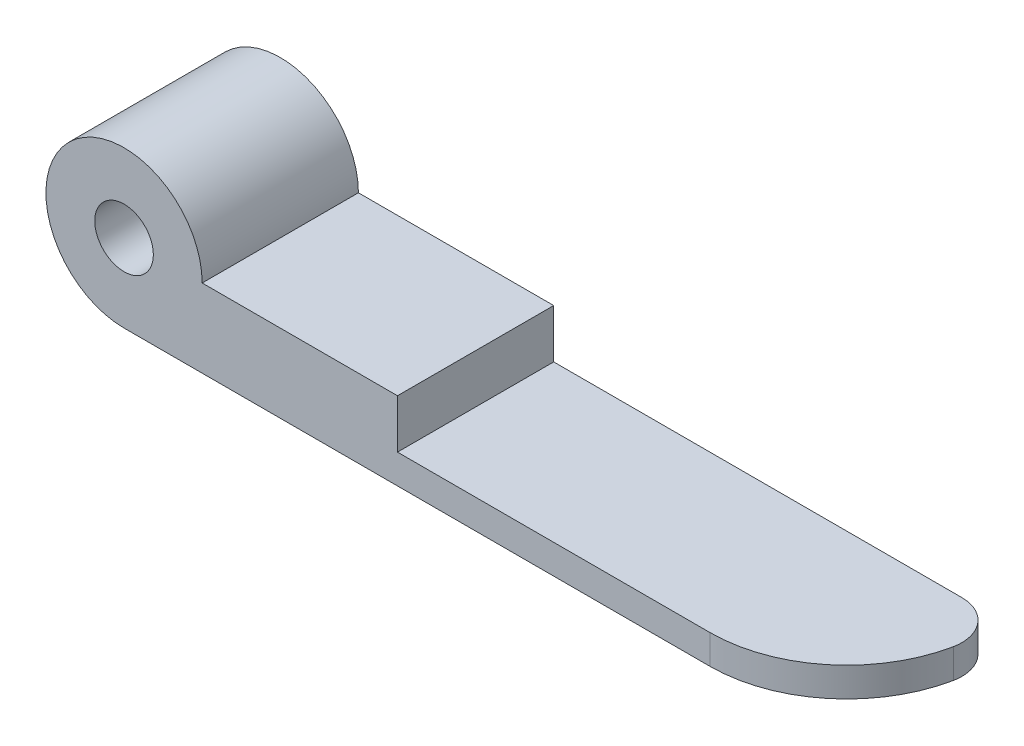
from build123d import *

# Parameters (mm, degrees)
CROQUIS1_R              = 1.5
SALIENTE_EXTRUIR1_DEPTH = 8
CROQUIS2_W              = 23
CROQUIS2_H              = 8
CORTAR_EXTRUIR1_DEPTH   = 2.5
REDONDEO1_R             = 7
REDONDEO3_R             = 2


with BuildPart() as part:
    # Croquis1 → Saliente-Extruir1 (new body)
    with BuildSketch(Plane.XY):
        with BuildLine():
            Line((37, 0), (4, 0))
            ThreePointArc((4, 0), (-2.828427125, 2.828427125), (0, -4))
            Line((0, -4), (37, -4))
            Line((37, -4), (37, 0))
        make_face()
        Circle(CROQUIS1_R, mode=Mode.SUBTRACT)
    extrude(amount=SALIENTE_EXTRUIR1_DEPTH)

    # Croquis2 → Cortar-Extruir1 (cut)
    with BuildSketch(Plane(origin=(0, 0, 0), x_dir=(1, 0, 0), z_dir=(0, 1, 0))):
        with Locations((25.5, -4)):
            Rectangle(CROQUIS2_W, CROQUIS2_H)
    extrude(amount=-CORTAR_EXTRUIR1_DEPTH, mode=Mode.SUBTRACT)

    # Redondeo1
    redondeo1_edges = [part.edges().sort_by_distance(p)[0] for p in [
        (37, -3.25, 8),
    ]]
    fillet(redondeo1_edges, radius=REDONDEO1_R)

    # Redondeo3
    redondeo3_edges = [part.edges().sort_by_distance(p)[0] for p in [
        (37, -3.25, 0),
    ]]
    fillet(redondeo3_edges, radius=REDONDEO3_R)


solid = part.part
